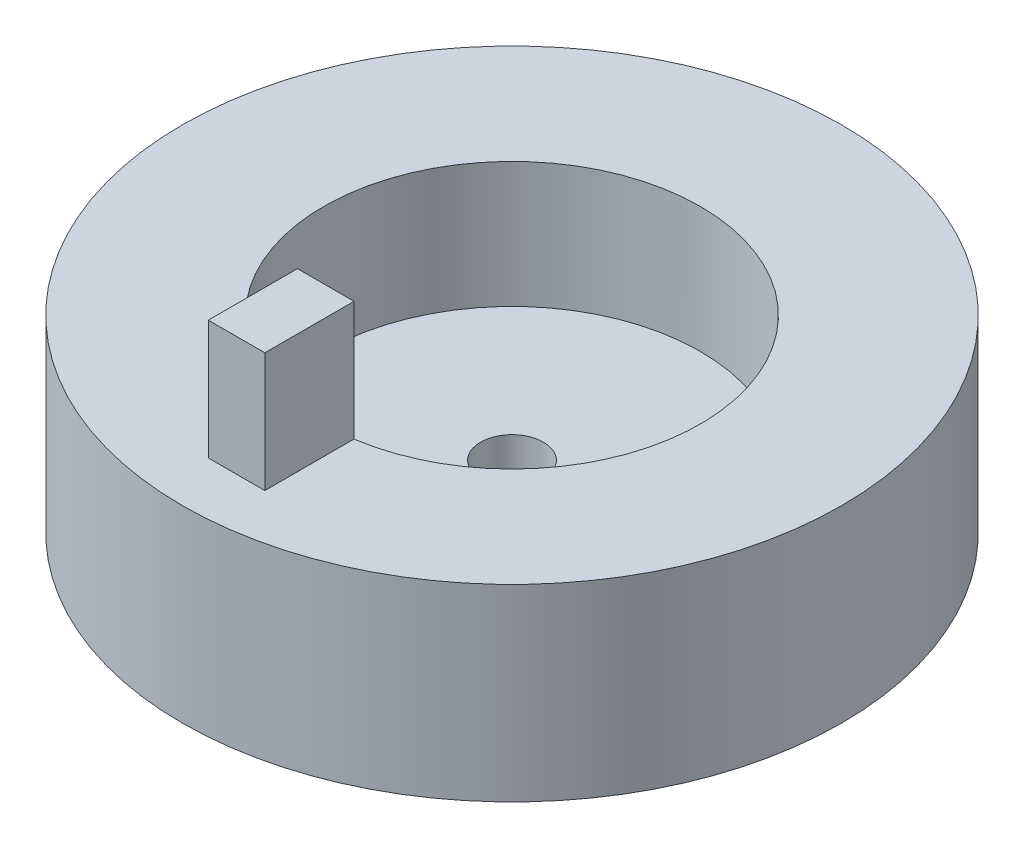
from build123d import *

# Parameters (mm, degrees)
SKIZZE1_R                       = 52.5
SKIZZE1_R_2                     = 30
AUFSATZ_LINEAR_AUSTRAGEN1_DEPTH = 20
AUFSATZ_LINEAR_START            = 10
SKIZZE2_R                       = 52.5
SKIZZE2_R_2                     = 5
AUFSATZ_LINEAR_AUSTRAGEN2_DEPTH = 10
SKIZZE3_W                       = 9
SKIZZE3_H                       = 14.2
AUFSATZ_LINEAR_AUSTRAGEN3_DEPTH = 19


with BuildPart() as part:
    # Skizze1 → Aufsatz-Linear austragen1 (new body)
    with BuildSketch(Plane(origin=(0, 0, 0), x_dir=(1, 0, 0), z_dir=(0, 1, 0))):
        with Locations(Location((0, 0, 0), (0, 0, 270))):
            Circle(SKIZZE1_R)
        with Locations(Location((0, 0, 0), (0, 0, 270))):
            Circle(SKIZZE1_R_2, mode=Mode.SUBTRACT)
    extrude(amount=AUFSATZ_LINEAR_AUSTRAGEN1_DEPTH)

    # Skizze2 → Aufsatz-Linear austragen2 (add)
    with BuildSketch(Plane.XZ.offset(AUFSATZ_LINEAR_START)):
        with Locations(Location((0, 0, 0), (0, 0, 270))):
            Circle(SKIZZE2_R)
        with Locations(Location((0, 0, 0), (0, 0, 270))):
            Circle(SKIZZE2_R_2, mode=Mode.SUBTRACT)
    extrude(amount=-AUFSATZ_LINEAR_AUSTRAGEN2_DEPTH)

    # Skizze3 → Aufsatz-Linear austragen3 (add)
    with BuildSketch(Plane(origin=(0, 20, 0), x_dir=(1, 0, 0), z_dir=(0, 1, 0))):
        with Locations((0, -36.7605799)):
            Rectangle(SKIZZE3_W, SKIZZE3_H)
    extrude(amount=AUFSATZ_LINEAR_AUSTRAGEN3_DEPTH)


solid = part.part
